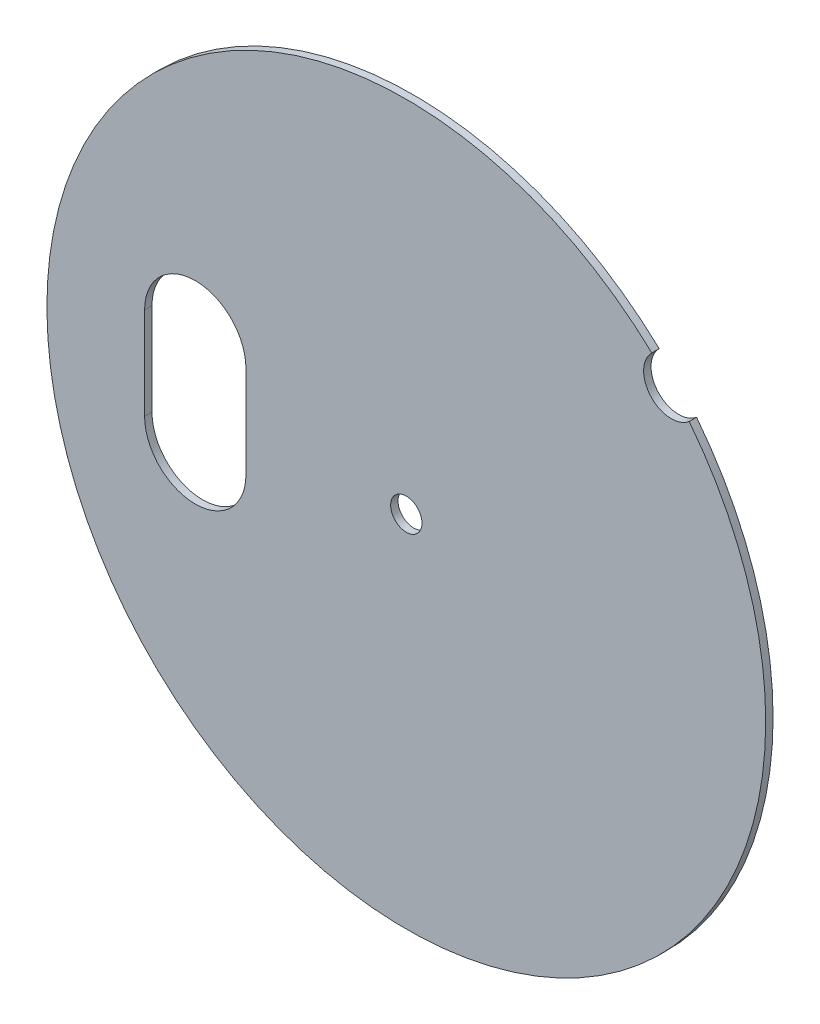
from build123d import *

# Parameters (mm, degrees)
ESQUISSE1_R        = 0.85
BOSS_EXTRU_1_DEPTH = 0.4


with BuildPart() as part:
    # Esquisse1 → Boss.-Extru.1 (new body)
    with BuildSketch(Plane.XY):
        with BuildLine():
            ThreePointArc((13.321737348, 14.240130408), (-14.376908068, -13.174009049), (15.347008325, 12.029934973))
            ThreePointArc((15.347008325, 12.029934973), (13.270992063, 12.160623737), (13.321737348, 14.240130408))
        make_face()
        Circle(ESQUISSE1_R, mode=Mode.SUBTRACT)
        with BuildLine():
            Line((-14.2, -2.5), (-14.2, 2.5))
            ThreePointArc((-14.2, 2.5), (-11.45, 5.25), (-8.7, 2.5))
            Line((-8.7, 2.5), (-8.7, -2.5))
            ThreePointArc((-8.7, -2.5), (-11.45, -5.25), (-14.2, -2.5))
        make_face(mode=Mode.SUBTRACT)
    extrude(amount=BOSS_EXTRU_1_DEPTH)


solid = part.part
